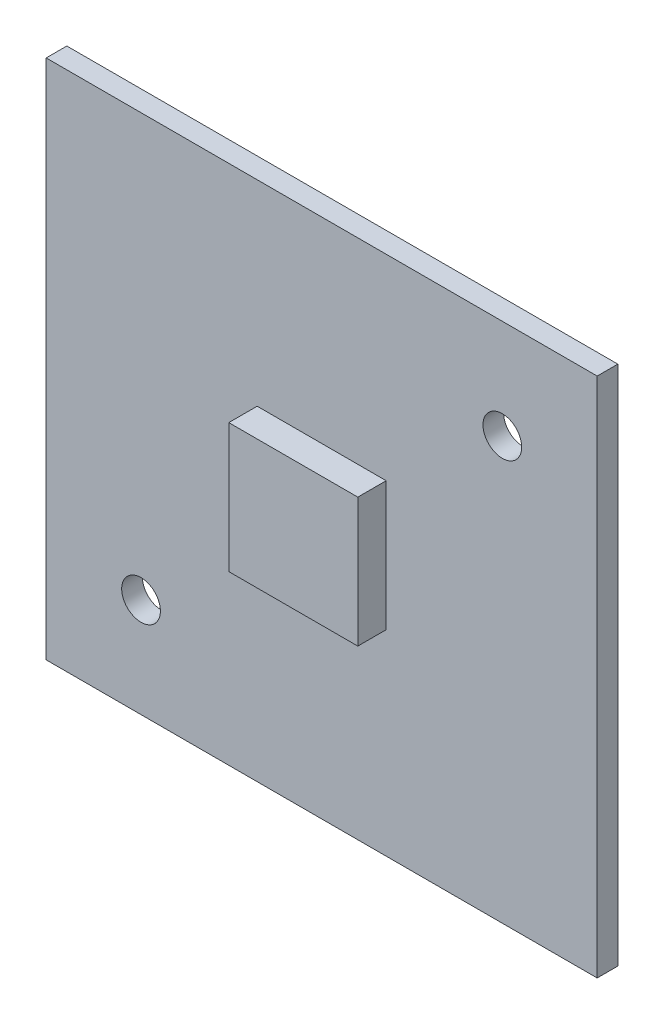
from build123d import *

# Parameters (mm, degrees)
V10_NFC_V3_REFERENCE42P7X40P4_START       = -10
SKETCH_2_W                                = 42.7
SKETCH_2_H                                = 40.4
V10_NFC_V3_REFERENCE42P7X40P4_DEPTH       = 1.6
V10_NFC_CENTRAL_COMPONENT_REFERENCE_START = -8.4
SKETCH_3_W                                = 10
SKETCH_3_H                                = 10
V10_NFC_CENTRAL_COMPONENT_REFERENCE_DEPTH = 2.2
SKETCH_5_R                                = 1.5
V12_NFC_TWO_DIAGONAL_PHOTO_HOLES_D3_DEPTH = 1.6


with BuildPart() as part:
    # 草图2 → V10_NFC_V3_reference42p7x40p4 (new body)
    with BuildSketch(Plane.XY.offset(V10_NFC_V3_REFERENCE42P7X40P4_START)):
        with Locations((100, 70)):
            Rectangle(SKETCH_2_W, SKETCH_2_H)
    extrude(amount=V10_NFC_V3_REFERENCE42P7X40P4_DEPTH)

    # 草图3 → V10_NFC_central_component_reference (add)
    with BuildSketch(Plane.XY.offset(V10_NFC_CENTRAL_COMPONENT_REFERENCE_START)):
        with Locations((100, 70)):
            Rectangle(SKETCH_3_W, SKETCH_3_H)
    extrude(amount=V10_NFC_CENTRAL_COMPONENT_REFERENCE_DEPTH)

    # 草图5 → V12_NFC_two_diagonal_photo_holes_D3 (cut)
    with BuildSketch(Plane.XY.offset(-8.4)):
        with Locations((86, 57.5)):
            Circle(SKETCH_5_R)
        with Locations((114, 82.5)):
            Circle(SKETCH_5_R)
    extrude(amount=-V12_NFC_TWO_DIAGONAL_PHOTO_HOLES_D3_DEPTH, mode=Mode.SUBTRACT)


solid = part.part
